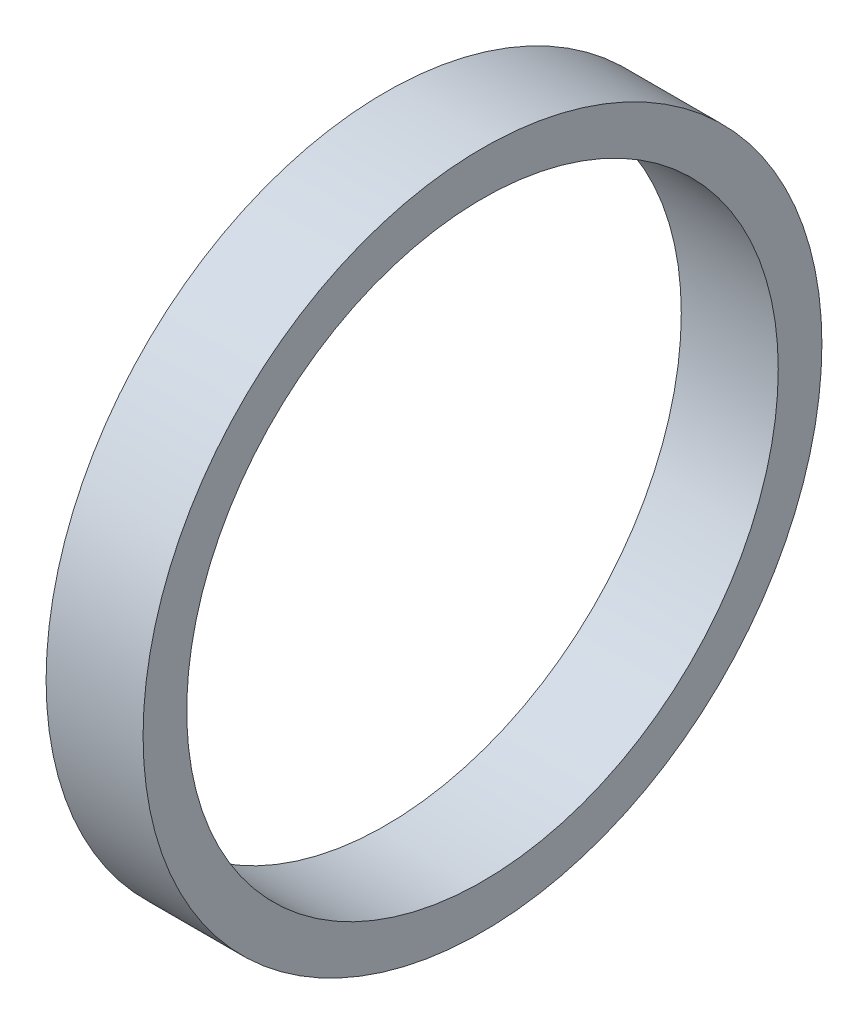
from build123d import *

# Parameters (mm, degrees)
SKETCH1_R           = 3.5
SKETCH1_R_2         = 3.05
BOSS_EXTRUDE1_DEPTH = 1


with BuildPart() as part:
    # Sketch1 → Boss-Extrude1 (new body)
    with BuildSketch(Plane(origin=(0, 0, 0), x_dir=(0, 0, -1), z_dir=(1, 0, 0))):
        Circle(SKETCH1_R)
        Circle(SKETCH1_R_2, mode=Mode.SUBTRACT)
    extrude(amount=BOSS_EXTRUDE1_DEPTH)


solid = part.part
